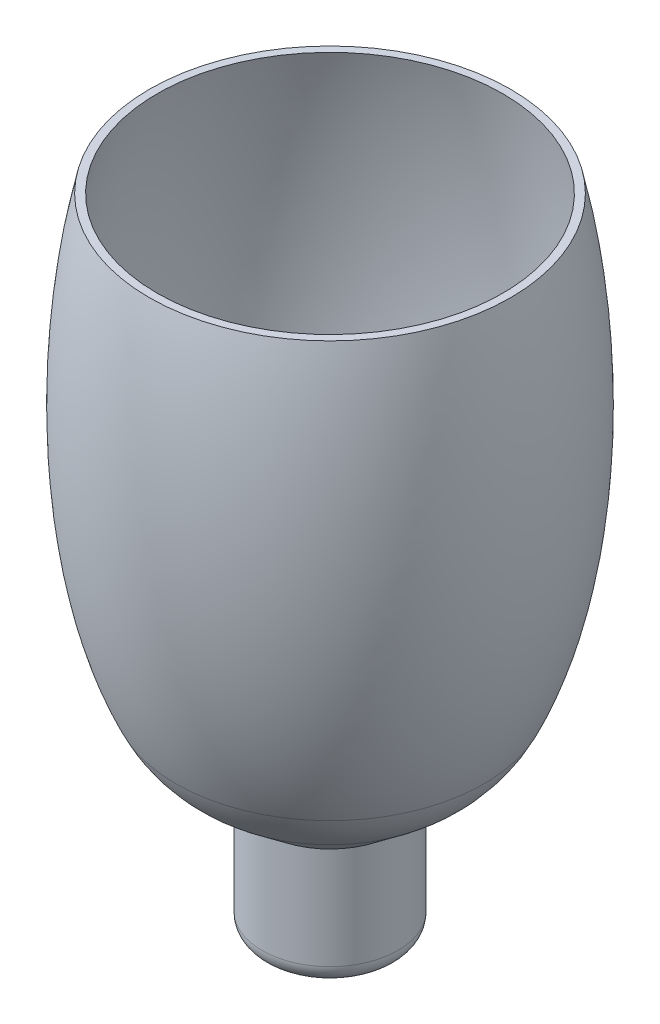
from build123d import *

# Parameters (mm, degrees)
SHELL1_T = -2


with BuildPart() as part:
    # Sketch1 → Revolve1 (revolve)
    with BuildSketch(Plane.XY, mode=Mode.PRIVATE) as revolve1_sk:
        with BuildLine():
            Line((0, 0), (0, 32))
            Line((0, 32), (-18, 32))
            Line((-18, 32), (-18, 5))
            ThreePointArc((-18, 5), (-16.535533906, 1.464466094), (-13, 0))
            Line((-13, 0), (0, 0))
        make_face()
    revolve(revolve1_sk.sketch.rotate(Axis((0, 0, 0), (0, 1, 0)), 270), axis=Axis((0, 0, 0), (0, 1, 0)))

    # Sketch2 → Revolve2 (revolve)
    with BuildSketch(Plane.XY, mode=Mode.PRIVATE) as revolve2_sk:
        with BuildLine():
            Line((0, 32), (0, 169.701834533))
            Line((0, 169.701834533), (-47.845940494, 169.701834533))
            add(Edge.make_bspline(
                [(-47.845940494, 169.701834533), (-56.027192674, 134.244588915), (-55.336931304, 85.561652437), (-40.809594918, 54.63591482)],
                knots=[0, 0, 0, 0, 0.888014655, 0.888014655, 0.888014655, 0.888014655], degree=3))
            ThreePointArc((-40.809594918, 54.63591482), (-36.507649182, 47.711012715), (-30.720397974, 41.96917244))
            Line((-30.720397974, 41.96917244), (-18, 32))
            Line((-18, 32), (0, 32))
        make_face()
    revolve(revolve2_sk.sketch.rotate(Axis((0, 32, 0), (0, 1, 0)), 270), axis=Axis((0, 32, 0), (0, 1, 0)))

    # Shell1
    shell1_openings = [part.faces().sort_by_distance(p)[0] for p in [
        (0, 169.701834533, 0),
    ]]
    offset(amount=SHELL1_T, openings=shell1_openings, kind=Kind.INTERSECTION)


solid = part.part
